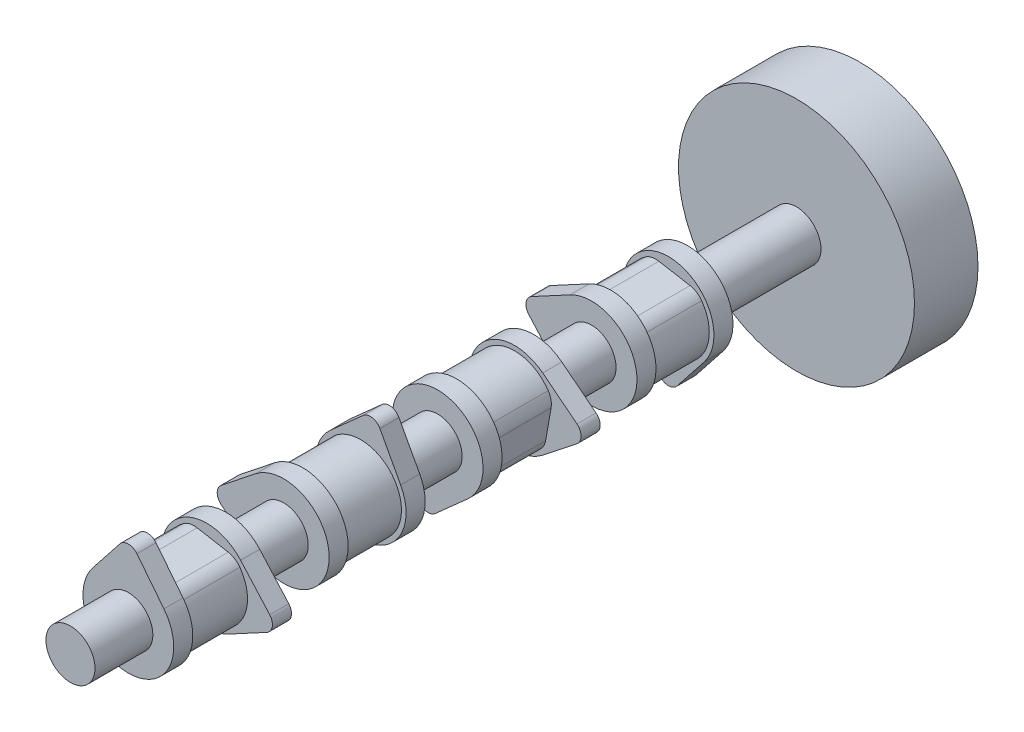
from build123d import *

# Parameters (mm, degrees)
CROQUIS1_R               = 65
SALIENTE_EXTRUIR2_DEPTH  = 35
CROQUIS2_R               = 13.5
SALIENTE_EXTRUIR3_DEPTH  = 400
CROQUIS3_R               = 13.5
SALIENTE_EXTRUIR4_DEPTH  = 10.5
CROQUIS4_R               = 13.5
SALIENTE_EXTRUIR6_DEPTH  = 10.5
CROQUIS5_R               = 13.5
SALIENTE_EXTRUIR7_DEPTH  = 10.5
CROQUIS6_R               = 13.5
SALIENTE_EXTRUIR8_DEPTH  = 10.5
CROQUIS7_R               = 13.5
SALIENTE_EXTRUIR9_DEPTH  = 10.5
CROQUIS8_R               = 13.5
SALIENTE_EXTRUIR10_DEPTH = 10.5
CROQUIS9_R               = 13.5
SALIENTE_EXTRUIR11_DEPTH = 10.5
CROQUIS10_R              = 13.5
SALIENTE_EXTRUIR12_DEPTH = 10.5
SALIENTE_EXTRUIR13_DEPTH = 32.7
SALIENTE_EXTRUIR14_DEPTH = 31.9
SALIENTE_EXTRUIR15_DEPTH = 31.9
SALIENTE_EXTRUIR16_DEPTH = 31.9


with BuildPart() as part:
    # Croquis1 → Saliente-Extruir2 (new body)
    with BuildSketch(Plane.XY):
        Circle(CROQUIS1_R)
    extrude(amount=SALIENTE_EXTRUIR2_DEPTH)

    # Croquis2 → Saliente-Extruir3 (add)
    with BuildSketch(Plane.XY.offset(35)):
        Circle(CROQUIS2_R)
    extrude(amount=SALIENTE_EXTRUIR3_DEPTH)

    # Croquis3 → Saliente-Extruir4 (add)
    with BuildSketch(Plane.XY.offset(392.6)):
        with BuildLine():
            Line((-19.616978627, 15.497553018), (-4.708074871, 34.369412724))
            ThreePointArc((-4.708074871, 34.369412724), (0, 36.65), (4.708074871, 34.369412724))
            Line((4.708074871, 34.369412724), (19.616978627, 15.497553018))
            ThreePointArc((19.616978627, 15.497553018), (0, -25), (-19.616978627, 15.497553018))
        make_face()
        Circle(CROQUIS3_R, mode=Mode.SUBTRACT)
    extrude(amount=SALIENTE_EXTRUIR4_DEPTH)

    # Croquis4 → Saliente-Extruir6 (add)
    with BuildSketch(Plane.XY.offset(349.4)):
        with BuildLine():
            Line((18.668562955, 16.627830803), (34.664812739, -1.331637253))
            ThreePointArc((34.664812739, -1.331637253), (36.093204148, -6.364205711), (33.029715496, -10.604734521))
            Line((33.029715496, -10.604734521), (11.855657775, -22.010074483))
            ThreePointArc((11.855657775, -22.010074483), (-24.620193825, 4.341204442), (18.668562955, 16.627830803))
        make_face()
        Circle(CROQUIS4_R, mode=Mode.SUBTRACT)
    extrude(amount=SALIENTE_EXTRUIR6_DEPTH)

    # Croquis5 → Saliente-Extruir7 (add)
    with BuildSketch(Plane.XY.offset(307)):
        with BuildLine():
            Line((-15.497553018, -19.616978627), (-34.369412724, -4.708074871))
            ThreePointArc((-34.369412724, -4.708074871), (-36.65, 0), (-34.369412724, 4.708074871))
            Line((-34.369412724, 4.708074871), (-15.497553018, 19.616978627))
            ThreePointArc((-15.497553018, 19.616978627), (25, 0), (-15.497553018, -19.616978627))
        make_face()
        Circle(CROQUIS5_R, mode=Mode.SUBTRACT)
    extrude(amount=SALIENTE_EXTRUIR7_DEPTH)

    # Croquis6 → Saliente-Extruir8 (add)
    with BuildSketch(Plane.XY.offset(264.6)):
        with BuildLine():
            Line((-16.627830803, 18.668562955), (1.331637253, 34.664812739))
            ThreePointArc((1.331637253, 34.664812739), (6.364205711, 36.093204148), (10.604734521, 33.029715496))
            Line((10.604734521, 33.029715496), (22.010074483, 11.855657775))
            ThreePointArc((22.010074483, 11.855657775), (-4.341204442, -24.620193825), (-16.627830803, 18.668562955))
        make_face()
        Circle(CROQUIS6_R, mode=Mode.SUBTRACT)
    extrude(amount=SALIENTE_EXTRUIR8_DEPTH)

    # Croquis7 → Saliente-Extruir9 (add)
    with BuildSketch(Plane.XY.offset(222.2)):
        with BuildLine():
            Line((16.627830803, -18.668562955), (-1.331637253, -34.664812739))
            ThreePointArc((-1.331637253, -34.664812739), (-6.364205711, -36.093204148), (-10.604734521, -33.029715496))
            Line((-10.604734521, -33.029715496), (-22.010074483, -11.855657775))
            ThreePointArc((-22.010074483, -11.855657775), (4.341204442, 24.620193825), (16.627830803, -18.668562955))
        make_face()
        Circle(CROQUIS7_R, mode=Mode.SUBTRACT)
    extrude(amount=SALIENTE_EXTRUIR9_DEPTH)

    # Croquis8 → Saliente-Extruir10 (add)
    with BuildSketch(Plane.XY.offset(179.8)):
        with BuildLine():
            Line((15.497553018, 19.616978627), (34.369412724, 4.708074871))
            ThreePointArc((34.369412724, 4.708074871), (36.65, 0), (34.369412724, -4.708074871))
            Line((34.369412724, -4.708074871), (15.497553018, -19.616978627))
            ThreePointArc((15.497553018, -19.616978627), (-25, 0), (15.497553018, 19.616978627))
        make_face()
        Circle(CROQUIS8_R, mode=Mode.SUBTRACT)
    extrude(amount=SALIENTE_EXTRUIR10_DEPTH)

    # Croquis9 → Saliente-Extruir11 (add)
    with BuildSketch(Plane.XY.offset(137.4)):
        with BuildLine():
            Line((-18.668562955, -16.627830803), (-34.664812739, 1.331637253))
            ThreePointArc((-34.664812739, 1.331637253), (-36.093204148, 6.364205711), (-33.029715496, 10.604734521))
            Line((-33.029715496, 10.604734521), (-11.855657775, 22.010074483))
            ThreePointArc((-11.855657775, 22.010074483), (24.620193825, -4.341204442), (-18.668562955, -16.627830803))
        make_face()
        Circle(CROQUIS9_R, mode=Mode.SUBTRACT)
    extrude(amount=SALIENTE_EXTRUIR11_DEPTH)

    # Croquis10 → Saliente-Extruir12 (add)
    with BuildSketch(Plane.XY.offset(95)):
        with BuildLine():
            Line((19.616978627, -15.497553018), (4.708074871, -34.369412724))
            ThreePointArc((4.708074871, -34.369412724), (0, -36.65), (-4.708074871, -34.369412724))
            Line((-4.708074871, -34.369412724), (-19.616978627, -15.497553018))
            ThreePointArc((-19.616978627, -15.497553018), (0, 25), (19.616978627, -15.497553018))
        make_face()
        Circle(CROQUIS10_R, mode=Mode.SUBTRACT)
    extrude(amount=SALIENTE_EXTRUIR12_DEPTH)

    # Croquis11 → Saliente-Extruir13 (add)
    with BuildSketch(Plane.XY.offset(359.9)):
        with BuildLine():
            Line((-5.302212899, 20.117414279), (11.86301125, 17.090722131))
            ThreePointArc((11.86301125, 17.090722131), (15.45729222, 15.703316474), (18.260288087, 13.060029823))
            ThreePointArc((18.260288087, 13.060029823), (-3.898401589, -22.108934055), (-12.692264697, 18.517800001))
            ThreePointArc((-12.692264697, 18.517800001), (-9.154252885, 20.042995913), (-5.302212899, 20.117414279))
        make_face()
    extrude(amount=SALIENTE_EXTRUIR13_DEPTH)

    # Croquis12 → Saliente-Extruir14 (add)
    with BuildSketch(Plane.XY.offset(275.1)):
        with BuildLine():
            Line((-20.117414279, -5.302212899), (-17.090722131, 11.86301125))
            ThreePointArc((-17.090722131, 11.86301125), (-15.703316474, 15.45729222), (-13.060029823, 18.260288087))
            ThreePointArc((-13.060029823, 18.260288087), (22.108934055, -3.898401589), (-18.517800001, -12.692264697))
            ThreePointArc((-18.517800001, -12.692264697), (-20.042995913, -9.154252885), (-20.117414279, -5.302212899))
        make_face()
    extrude(amount=SALIENTE_EXTRUIR14_DEPTH)

    # Croquis14 → Saliente-Extruir15 (add)
    with BuildSketch(Plane.XY.offset(190.3)):
        with BuildLine():
            Line((20.117414279, 5.302212899), (17.090722131, -11.86301125))
            ThreePointArc((17.090722131, -11.86301125), (15.703316474, -15.45729222), (13.060029823, -18.260288087))
            ThreePointArc((13.060029823, -18.260288087), (-22.108934055, 3.898401589), (18.517800001, 12.692264697))
            ThreePointArc((18.517800001, 12.692264697), (20.042995913, 9.154252885), (20.117414279, 5.302212899))
        make_face()
    extrude(amount=SALIENTE_EXTRUIR15_DEPTH)

    # Croquis15 → Saliente-Extruir16 (add)
    with BuildSketch(Plane.XY.offset(105.5)):
        with BuildLine():
            Line((-5.302212899, 20.117414279), (11.86301125, 17.090722131))
            ThreePointArc((11.86301125, 17.090722131), (15.45729222, 15.703316474), (18.260288087, 13.060029823))
            ThreePointArc((18.260288087, 13.060029823), (-3.898401589, -22.108934055), (-12.692264697, 18.517800001))
            ThreePointArc((-12.692264697, 18.517800001), (-9.154252885, 20.042995913), (-5.302212899, 20.117414279))
        make_face()
    extrude(amount=SALIENTE_EXTRUIR16_DEPTH)


solid = part.part
